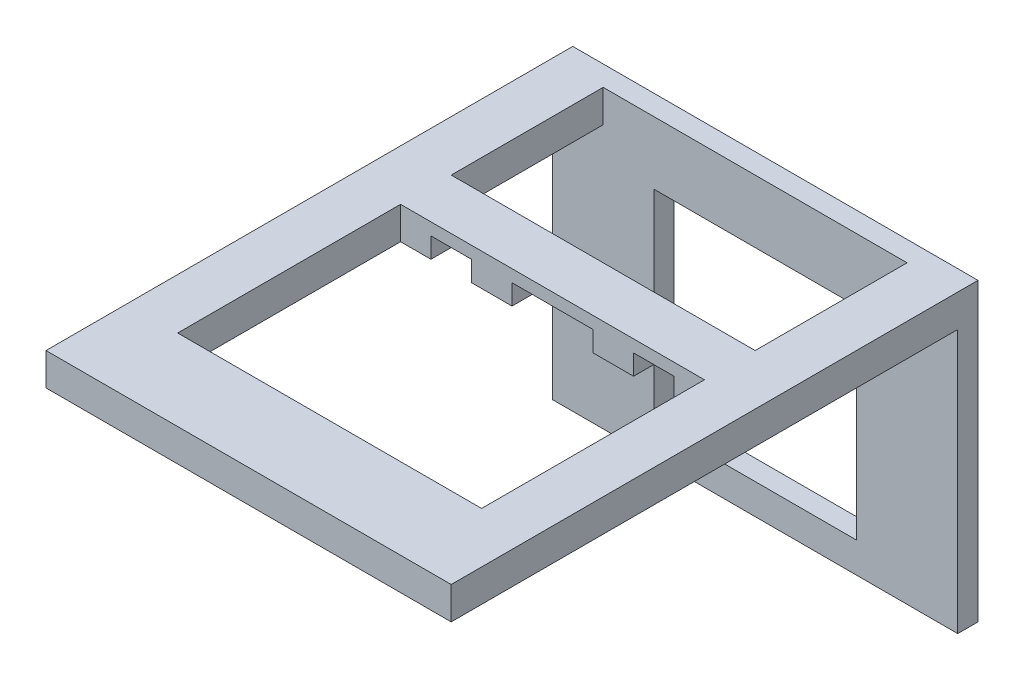
from build123d import *

# Parameters (mm, degrees)
SKETCH_3_W          = 10
SKETCH_3_H          = 1.5
EXTRUDE_1_DEPTH     = 1
EXTRUDE_2_DEPTH     = 1.6
CUT_EXTRUDE_1_REACH = 30.975
SKETCH_6_W          = 2
SKETCH_6_H          = 1
SKETCH_6_W_2        = 4


with BuildPart() as part:
    # 草图3 → 凸台-拉伸1 (new body)
    with BuildSketch(Plane.XY):
        Polygon((5, 7.602908894), (5, -2.397091106), (-5, -2.397091106), (-5, 7.602908894), (-5, 9.102908894), (-10, 9.102908894), (-10, -3.897091106), (10, -3.897091106), (10, 9.102908894), (5, 9.102908894), align=None)
        with Locations((0, 8.352908894)):
            Rectangle(SKETCH_3_W, SKETCH_3_H)
    extrude(amount=EXTRUDE_1_DEPTH)

    # 草图4 → 凸台-拉伸2 (add)
    with BuildSketch(Plane(origin=(0, 9.102908894, 0), x_dir=(1, 0, 0), z_dir=(0, 1, 0))):
        Polygon((10, -1), (10, 0), (0, 0), (0, -1), (7.5, -1), align=None)
        Polygon((0, -1), (0, 0), (-10, 0), (-10, -1), (-7.5, -1), align=None)
        Polygon((-7.5, -1), (-10, -1), (-10, -26), (0, -26), (0, -22), (-7.5, -22), (-7.5, -11), (0, -11), (0, -8.5), (-7.5, -8.5), align=None)
        Polygon((10, -26), (10, -1), (7.5, -1), (7.5, -8.5), (0, -8.5), (0, -11), (7.5, -11), (7.5, -22), (0, -22), (0, -26), align=None)
    extrude(amount=EXTRUDE_2_DEPTH)

    # 草图6 → 切除-拉伸1 (cut, up to next)
    with BuildSketch(Plane.XY.offset(1), mode=Mode.PRIVATE) as cut_extrude_1_sk1:
        with Locations((-5, 9.602908894)):
            Rectangle(SKETCH_6_W, SKETCH_6_H)
    cut_extrude_1_tool1 = extrude(cut_extrude_1_sk1.sketch, amount=CUT_EXTRUDE_1_REACH, mode=Mode.PRIVATE) & part.part
    # 草图6 → 切除-拉伸1 (cut, up to next)
    with BuildSketch(Plane.XY.offset(1), mode=Mode.PRIVATE) as cut_extrude_1_sk2:
        with Locations((5, 9.602908894)):
            Rectangle(SKETCH_6_W, SKETCH_6_H)
    cut_extrude_1_tool2 = extrude(cut_extrude_1_sk2.sketch, amount=CUT_EXTRUDE_1_REACH, mode=Mode.PRIVATE) & part.part
    # 草图6 → 切除-拉伸1 (cut, up to next)
    with BuildSketch(Plane.XY.offset(1), mode=Mode.PRIVATE) as cut_extrude_1_sk3:
        with Locations((0, 9.602908894)):
            Rectangle(SKETCH_6_W_2, SKETCH_6_H)
    cut_extrude_1_tool3 = extrude(cut_extrude_1_sk3.sketch, amount=CUT_EXTRUDE_1_REACH, mode=Mode.PRIVATE) & part.part
    add(cut_extrude_1_tool1.solids().sort_by_distance((-5, 9.602909, 1))[0], mode=Mode.SUBTRACT)
    add(cut_extrude_1_tool2.solids().sort_by_distance((5, 9.602909, 1))[0], mode=Mode.SUBTRACT)
    add(cut_extrude_1_tool3.solids().sort_by_distance((0, 9.602909, 1))[0], mode=Mode.SUBTRACT)


solid = part.part
